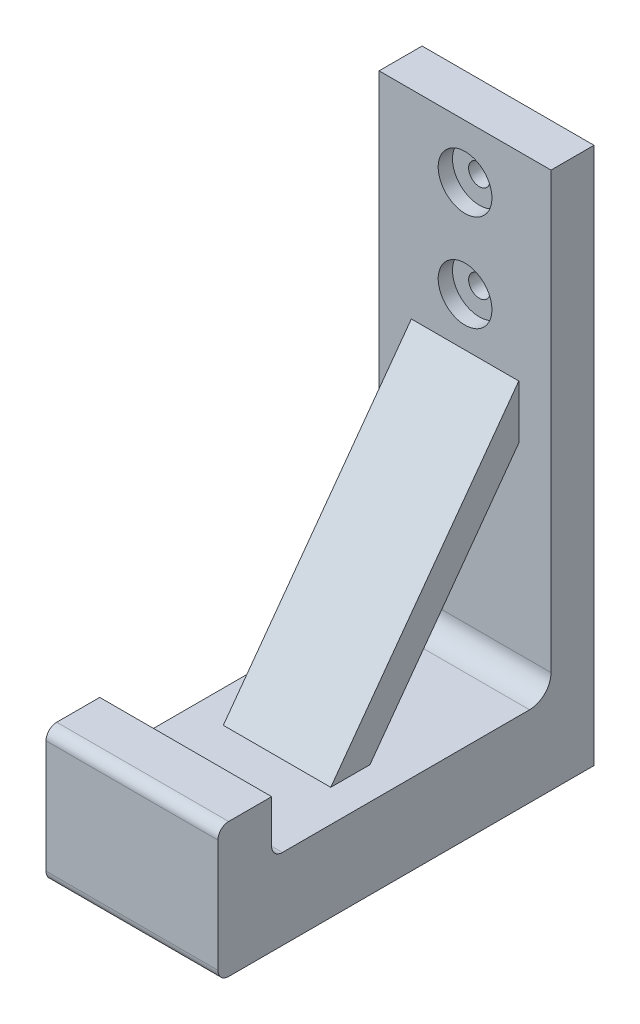
from build123d import *

# Parameters (mm, degrees)
BOSS_EXTRUDE1_DEPTH                              = 20.32
BOSS_EXTRUDE2_DEPTH                              = 12.7
CBORE_FOR_10_PAN_HEAD_MACHINE_SCREW1_D           = 5.08
CBORE_FOR_10_PAN_HEAD_MACHINE_SCREW1_CBORE_D     = 12.7
CBORE_FOR_10_PAN_HEAD_MACHINE_SCREW1_CBORE_DEPTH = 3.3782
FILLET1_R                                        = 5.08
FILLET2_R                                        = 2.54
FILLET3_R                                        = 2.54
FILLET4_R                                        = 2.54


with BuildPart() as part:
    # Sketch1 → Boss-Extrude1 (new, symmetric)
    with BuildSketch(Plane(origin=(0, 0, 0), x_dir=(0, 0, -1), z_dir=(1, 0, 0))):
        Polygon((0, 0), (0, 127), (-10.16, 127), (-10.16, 19.05), (-76.2, 19.05), (-76.2, 31.75), (-88.9, 31.75), (-88.9, 0), align=None)
    extrude(amount=BOSS_EXTRUDE1_DEPTH, both=True)

    # Sketch1<9> → Boss-Extrude2 (add, symmetric)
    with BuildSketch(Plane(origin=(0, 0, 0), x_dir=(0, 0, -1), z_dir=(1, 0, 0))):
        Polygon((-54.61, 19.05), (-10.16, 80.01), (-10.16, 67.31), (-45.349583333, 19.05), align=None)
    extrude(amount=BOSS_EXTRUDE2_DEPTH, both=True)

    # CBORE for #10 Pan Head Machine Screw1 (through all)
    with Locations(Plane.XY.offset(10.16)):
        with Locations((0, 91.44), (0, 114.3)):
            CounterBoreHole(CBORE_FOR_10_PAN_HEAD_MACHINE_SCREW1_D / 2, CBORE_FOR_10_PAN_HEAD_MACHINE_SCREW1_CBORE_D / 2, CBORE_FOR_10_PAN_HEAD_MACHINE_SCREW1_CBORE_DEPTH)

    # Fillet1
    fillet1_edges = [part.edges().sort_by_distance(p)[0] for p in [
        (0, 19.05, 10.16),
    ]]
    fillet(fillet1_edges, radius=FILLET1_R)

    # Fillet2
    fillet2_edges = [part.edges().sort_by_distance(p)[0] for p in [
        (0, 19.05, 76.2),
    ]]
    fillet(fillet2_edges, radius=FILLET2_R)

    # Fillet3
    fillet3_edges = [part.edges().sort_by_distance(p)[0] for p in [
        (0, 0, 88.9),
    ]]
    fillet(fillet3_edges, radius=FILLET3_R)

    # Fillet4
    fillet4_edges = [part.edges().sort_by_distance(p)[0] for p in [
        (0, 31.75, 88.9),
    ]]
    fillet(fillet4_edges, radius=FILLET4_R)


solid = part.part
